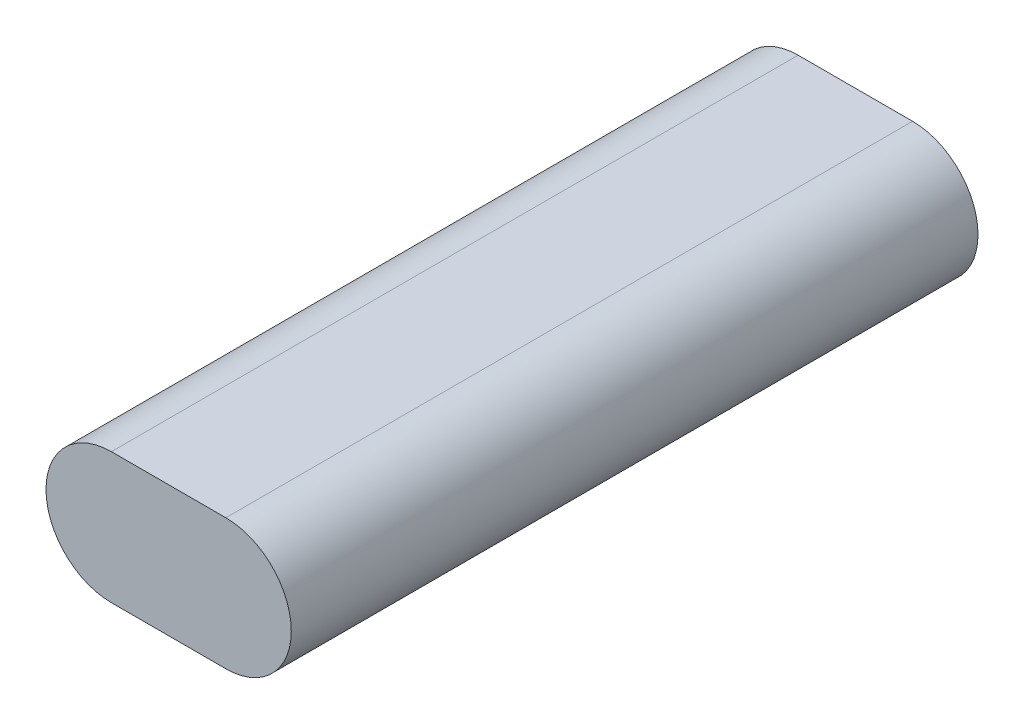
from build123d import *

# Parameters (mm, degrees)
BOSS_EXTRUDE1_DEPTH = 133.35


with BuildPart() as part:
    # Sketch1 → Boss-Extrude1 (new body)
    with BuildSketch(Plane.XY):
        with BuildLine():
            Line((-13.868711656, 12.7), (8.356288344, 12.7))
            ThreePointArc((8.356288344, 12.7), (21.056288344, 0), (8.356288344, -12.7))
            Line((8.356288344, -12.7), (-13.868711656, -12.7))
            ThreePointArc((-13.868711656, -12.7), (-26.568711656, 0), (-13.868711656, 12.7))
        make_face()
    extrude(amount=BOSS_EXTRUDE1_DEPTH)


solid = part.part
